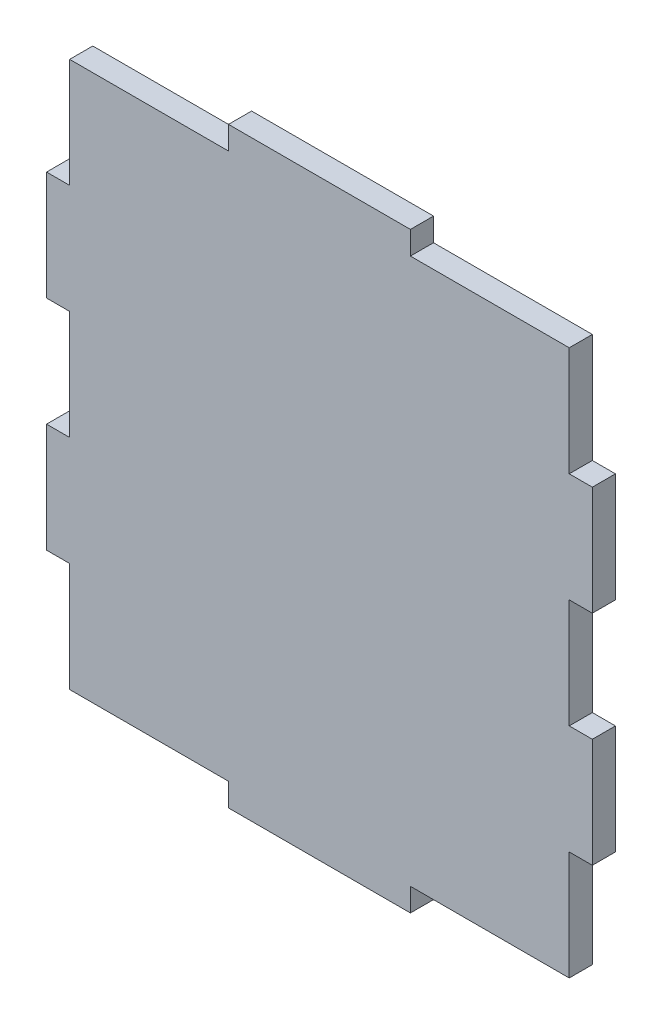
from build123d import *

# Parameters (mm, degrees)
BOSS_EXTRUDE1_DEPTH = 6.35


with BuildPart() as part:
    # Sketch1 → Boss-Extrude1 (new body)
    with BuildSketch(Plane.XY):
        Polygon((105.283018868, -33.117921942), (105.283018868, -63.117921942), (98.933018868, -63.117921942), (98.933018868, -93.117921942), (55.283018868, -93.117921942), (55.283018868, -99.467921942), (5.283018868, -99.467921942), (5.283018868, -93.117921942), (-38.366981132, -93.117921942), (-38.366981132, -63.117921942), (-44.716981132, -63.117921942), (-44.716981132, -33.117921942), (-38.366981132, -33.117921942), (-38.366981132, -3.117921942), (-44.716981132, -3.117921942), (-44.716981132, 26.882078058), (-38.366981132, 26.882078058), (-38.366981132, 56.882078058), (5.283018868, 56.882078058), (5.283018868, 63.232078058), (55.283018868, 63.232078058), (55.283018868, 56.882078058), (98.933018868, 56.882078058), (98.933018868, 26.882078058), (105.283018868, 26.882078058), (105.283018868, -3.117921942), (98.933018868, -3.117921942), (98.933018868, -33.117921942), align=None)
    extrude(amount=BOSS_EXTRUDE1_DEPTH)


solid = part.part
